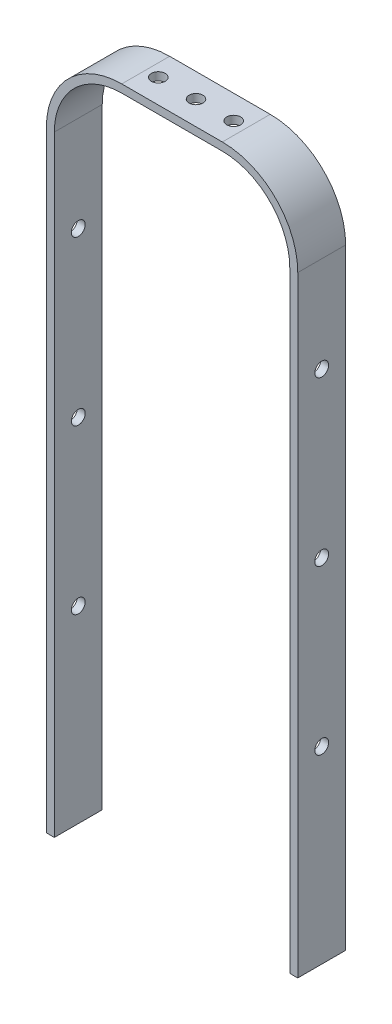
from build123d import *

# Parameters (mm, degrees)
BOSS_EXTRUDE1_DEPTH     = 9.525
SKETCH12_R              = 2.75
CUT_EXTRUDE2_DEPTH      = 278.704385318
CUT_EXTRUDE3_DEPTH      = 291.894698516
CUT_EXTRUDE3_DEPTH_BACK = 291.894698516
SKETCH13_R              = 2.75


with BuildPart() as part:
    # Sketch1 → Boss-Extrude1 (new, symmetric)
    with BuildSketch(Plane.XY):
        with BuildLine():
            Line((50, 0), (50, 243))
            ThreePointArc((50, 243), (41.213203436, 264.213203436), (20, 273))
            Line((20, 273), (-20, 273))
            ThreePointArc((-20, 273), (-41.213203436, 264.213203436), (-50, 243))
            Line((-50, 243), (-50, 0))
            Line((-50, 0), (-46.825, 0))
            Line((-46.825, 0), (-46.825, 243))
            ThreePointArc((-46.825, 243), (-38.968139405, 261.968139405), (-20, 269.825))
            Line((-20, 269.825), (20, 269.825))
            ThreePointArc((20, 269.825), (38.968139405, 261.968139405), (46.825, 243))
            Line((46.825, 243), (46.825, 0))
            Line((46.825, 0), (50, 0))
        make_face()
    extrude(amount=BOSS_EXTRUDE1_DEPTH, both=True)

    # Sketch12 → Cut-Extrude2 (cut, through all)
    with BuildSketch(Plane(origin=(0, 273, 0), x_dir=(1, 0, 0), z_dir=(0, 1, 0))):
        with Locations(Location((0, 0, 0), (0, 0, 270))):
            Circle(SKETCH12_R)
        with Locations(Location((-15, 0, 0), (0, 0, 270))):
            Circle(SKETCH12_R)
        with Locations(Location((15, 0, 0), (0, 0, 270))):
            Circle(SKETCH12_R)
    extrude(amount=-CUT_EXTRUDE2_DEPTH, mode=Mode.SUBTRACT)

    # Sketch13 → Cut-Extrude3 (cut, two sides: drawn at the far end of the back side and taken through both)
    with BuildSketch(Plane(origin=(50, 0, 0), x_dir=(0, 0, -1), z_dir=(1, 0, 0)).offset(-CUT_EXTRUDE3_DEPTH_BACK)):
        with Locations((0, 205)):
            Circle(SKETCH13_R)
        with Locations((0, 140)):
            Circle(SKETCH13_R)
        with Locations((0, 75)):
            Circle(SKETCH13_R)
    extrude(amount=CUT_EXTRUDE3_DEPTH + CUT_EXTRUDE3_DEPTH_BACK, mode=Mode.SUBTRACT)


solid = part.part
